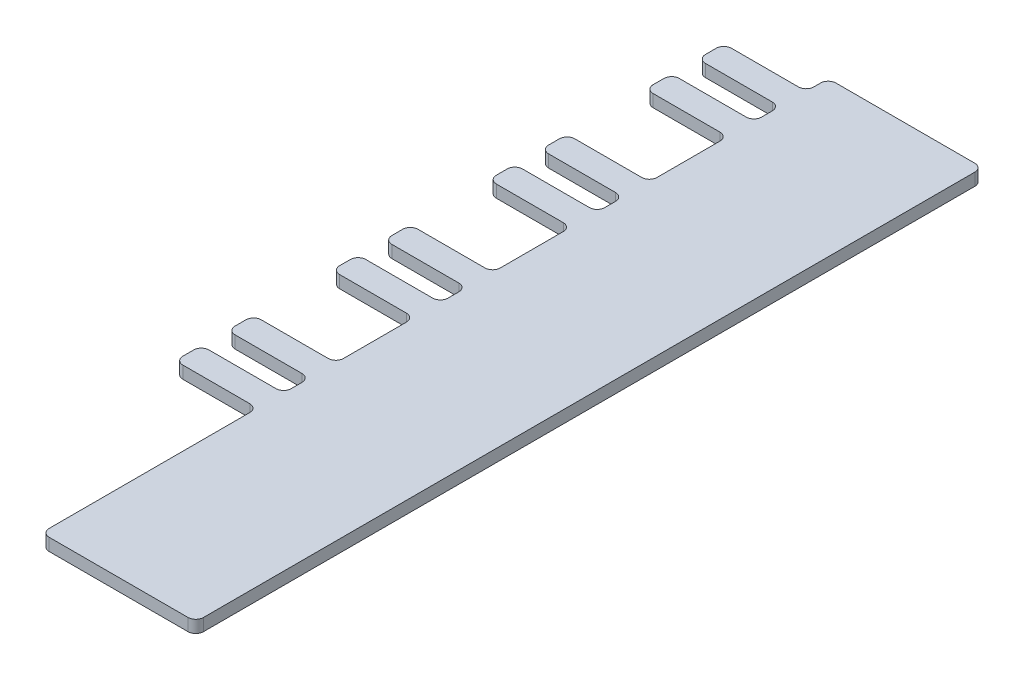
from build123d import *

# Parameters (mm, degrees)
BOSS_EXTRUDE1_DEPTH = 1.2


with BuildPart() as part:
    # Sketch1 → Boss-Extrude1 (new body)
    with BuildSketch(Plane(origin=(0, 0, 0), x_dir=(1, 0, 0), z_dir=(0, 1, 0))):
        with BuildLine():
            Line((-0.75, 21), (-7.25, 21))
            ThreePointArc((-7.25, 21), (-7.780330086, 21.219669914), (-8, 21.75))
            Line((-8, 21.75), (-8, 22.79))
            ThreePointArc((-8, 22.79), (-7.780330086, 23.320330086), (-7.25, 23.54))
            Line((-7.25, 23.54), (-0.746230206, 23.54))
            ThreePointArc((-0.746230206, 23.54), (-0.243153345, 23.733750351), (0, 24.214896874))
            Line((0, 24.214896874), (0, 25.33))
            ThreePointArc((0, 25.33), (-0.219669914, 25.860330086), (-0.75, 26.08))
            Line((-0.75, 26.08), (-7.25, 26.08))
            ThreePointArc((-7.25, 26.08), (-7.780330086, 26.299669914), (-8, 26.83))
            Line((-8, 26.83), (-8, 27.87))
            ThreePointArc((-8, 27.87), (-7.780330086, 28.400330086), (-7.25, 28.62))
            Line((-7.25, 28.62), (-0.746230206, 28.62))
            ThreePointArc((-0.746230206, 28.62), (-0.243153345, 28.813750351), (0, 29.294896874))
            Line((0, 29.294896874), (0, 35.49))
            ThreePointArc((0, 35.49), (-0.219669914, 36.020330086), (-0.75, 36.24))
            Line((-0.75, 36.24), (-7.25, 36.24))
            ThreePointArc((-7.25, 36.24), (-7.780330086, 36.459669914), (-8, 36.99))
            Line((-8, 36.99), (-8, 38.03))
            ThreePointArc((-8, 38.03), (-7.780330086, 38.560330086), (-7.25, 38.78))
            Line((-7.25, 38.78), (-0.746230206, 38.78))
            ThreePointArc((-0.746230206, 38.78), (-0.243153345, 38.973750351), (0, 39.454896874))
            Line((0, 39.454896874), (0, 40.57))
            ThreePointArc((0, 40.57), (-0.219669914, 41.100330086), (-0.75, 41.32))
            Line((-0.75, 41.32), (-7.25, 41.32))
            ThreePointArc((-7.25, 41.32), (-7.780330086, 41.539669914), (-8, 42.07))
            Line((-8, 42.07), (-8, 43.11))
            ThreePointArc((-8, 43.11), (-7.780330086, 43.640330086), (-7.25, 43.86))
            Line((-7.25, 43.86), (-0.746230206, 43.86))
            ThreePointArc((-0.746230206, 43.86), (-0.243153345, 44.053750351), (0, 44.534896874))
            Line((0, 44.534896874), (0, 50.73))
            ThreePointArc((0, 50.73), (-0.219669914, 51.260330086), (-0.75, 51.48))
            Line((-0.75, 51.48), (-7.25, 51.48))
            ThreePointArc((-7.25, 51.48), (-7.780330086, 51.699669914), (-8, 52.23))
            Line((-8, 52.23), (-8, 53.27))
            ThreePointArc((-8, 53.27), (-7.780330086, 53.800330086), (-7.25, 54.02))
            Line((-7.25, 54.02), (-0.746230206, 54.02))
            ThreePointArc((-0.746230206, 54.02), (-0.243153345, 54.213750351), (0, 54.694896874))
            Line((0, 54.694896874), (0, 55.81))
            ThreePointArc((0, 55.81), (-0.219669914, 56.340330086), (-0.75, 56.56))
            Line((-0.75, 56.56), (-7.25, 56.56))
            ThreePointArc((-7.25, 56.56), (-7.780330086, 56.779669914), (-8, 57.31))
            Line((-8, 57.31), (-8, 58.35))
            ThreePointArc((-8, 58.35), (-7.780330086, 58.880330086), (-7.25, 59.1))
            Line((-7.25, 59.1), (-0.746230206, 59.1))
            ThreePointArc((-0.746230206, 59.1), (-0.243153345, 59.293750351), (0, 59.774896874))
            Line((0, 59.774896874), (0, 65.97))
            ThreePointArc((0, 65.97), (-0.219669914, 66.500330086), (-0.75, 66.72))
            Line((-0.75, 66.72), (-7.25, 66.72))
            ThreePointArc((-7.25, 66.72), (-7.780330086, 66.939669914), (-8, 67.47))
            Line((-8, 67.47), (-8, 68.51))
            ThreePointArc((-8, 68.51), (-7.780330086, 69.040330086), (-7.25, 69.26))
            Line((-7.25, 69.26), (-0.746230206, 69.26))
            ThreePointArc((-0.746230206, 69.26), (-0.243153345, 69.453750351), (0, 69.934896874))
            Line((0, 69.934896874), (0, 71.05))
            ThreePointArc((0, 71.05), (-0.219669914, 71.580330086), (-0.75, 71.8))
            Line((-0.75, 71.8), (-7.25, 71.8))
            ThreePointArc((-7.25, 71.8), (-7.780330086, 72.019669914), (-8, 72.55))
            Line((-8, 72.55), (-8, 73.59))
            ThreePointArc((-8, 73.59), (-7.780330086, 74.120330086), (-7.25, 74.34))
            Line((-7.25, 74.34), (-0.746230206, 74.34))
            ThreePointArc((-0.746230206, 74.34), (-0.243153345, 74.533750351), (0, 75.014896874))
            Line((0, 75.014896874), (0, 75.74))
            ThreePointArc((0, 75.74), (0.219669914, 76.270330086), (0.75, 76.49))
            Line((0.75, 76.49), (14.25, 76.49))
            ThreePointArc((14.25, 76.49), (14.780330086, 76.270330086), (15, 75.74))
            Line((15, 75.74), (15, 0.75))
            ThreePointArc((15, 0.75), (14.780330086, 0.219669914), (14.25, 0))
            Line((14.25, 0), (0.75, 0))
            ThreePointArc((0.75, 0), (0.219669914, 0.219669914), (0, 0.75))
            Line((0, 0.75), (0, 20.25))
            ThreePointArc((0, 20.25), (-0.219669914, 20.780330086), (-0.75, 21))
        make_face()
    extrude(amount=BOSS_EXTRUDE1_DEPTH)


solid = part.part
